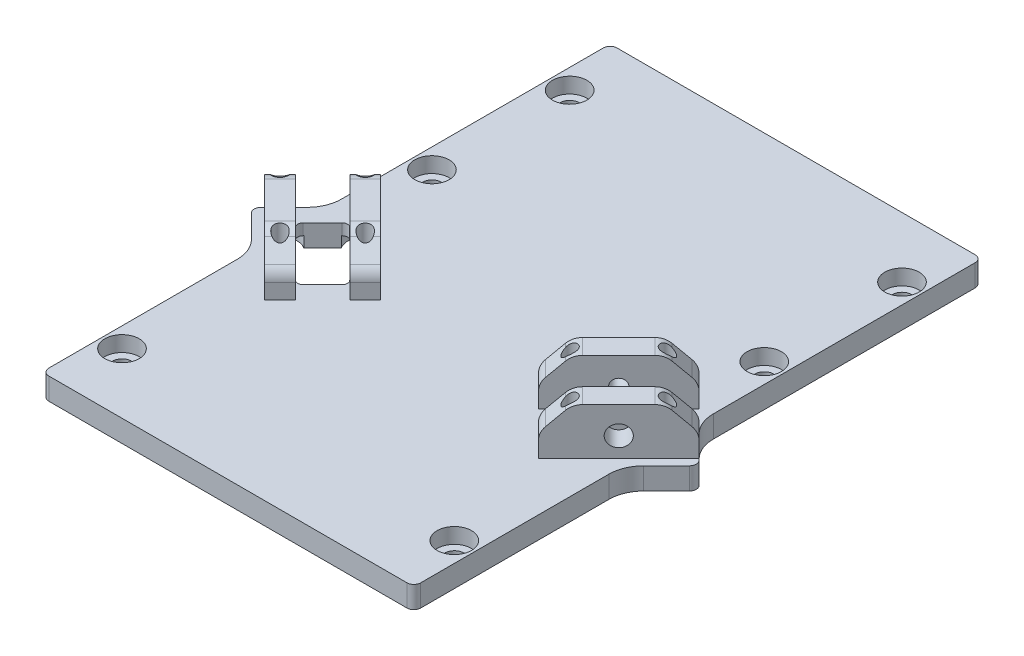
from build123d import *

# Parameters (mm, degrees)
SKETCH1_W                           = 130
SKETCH1_H                           = 55
BOSS_EXTRUDE1_DEPTH                 = 6.35
BOSS_EXTRUDE2_DEPTH                 = 13.5
BOSS_EXTRUDE2_2_DEPTH               = 13.5
SKETCH4_W                           = 2.1
SKETCH4_H                           = 107.03086207
CHAMFER1_SIZE                       = 7
FILLET1_R                           = 5
CHAMFER2_SIZE                       = 7
FILLET2_R                           = 5
CUT_EXTRUDE1_DEPTH                  = 72.857497869
SKETCH10_W                          = 3
SKETCH10_H                          = 107.03086207
SKETCH12_W                          = 1.9
SKETCH12_H                          = 19.85
F_3_8_3_8_DIAMETER_HOLE1_AT_2_COUNT = 2
F_3_8_3_8_DIAMETER_HOLE1_AT_2_PITCH = 20
F_3_8_3_8_DIAMETER_HOLE1_AT_3_COUNT = 2
F_3_8_3_8_DIAMETER_HOLE1_AT_3_PITCH = 26.575364532
F_3_8_3_8_DIAMETER_HOLE1_AT_4_COUNT = 2
F_3_8_3_8_DIAMETER_HOLE1_AT_4_PITCH = 17.5
F_3_8_3_8_DIAMETER_HOLE1_AT_5_COUNT = 2
F_3_8_3_8_DIAMETER_HOLE1_AT_5_PITCH = 87.767766953
F_3_8_3_8_DIAMETER_HOLE1_AT_6_COUNT = 2
F_3_8_3_8_DIAMETER_HOLE1_AT_6_PITCH = 100.903777567
F_3_8_3_8_DIAMETER_HOLE1_AT_7_COUNT = 2
F_3_8_3_8_DIAMETER_HOLE1_AT_7_PITCH = 89.995138758
F_3_8_3_8_DIAMETER_HOLE1_AT_8_COUNT = 2
F_3_8_3_8_DIAMETER_HOLE1_AT_8_PITCH = 74.971551862
CBORE_FOR_M5_SHCS2_AT_2_COUNT       = 2
CBORE_FOR_M5_SHCS2_AT_2_PITCH       = 20
CBORE_FOR_M5_SHCS2_AT_3_COUNT       = 2
CBORE_FOR_M5_SHCS2_AT_3_PITCH       = 17.5
CBORE_FOR_M5_SHCS2_AT_4_COUNT       = 2
CBORE_FOR_M5_SHCS2_AT_4_PITCH       = 26.575364532
CBORE_FOR_M5_SHCS2_AT_5_COUNT       = 2
CBORE_FOR_M5_SHCS2_AT_5_PITCH       = 86.018166686
CBORE_FOR_M5_SHCS2_AT_6_COUNT       = 2
CBORE_FOR_M5_SHCS2_AT_6_PITCH       = 72.915551652
CBORE_FOR_M5_SHCS2_AT_7_COUNT       = 2
CBORE_FOR_M5_SHCS2_AT_7_PITCH       = 74.971551862
CBORE_FOR_M5_SHCS2_AT_8_COUNT       = 2
CBORE_FOR_M5_SHCS2_AT_8_PITCH       = 59.483495706
SKETCH7_W                           = 108
SKETCH7_H                           = 68
SKETCH7_H_2                         = 42
BOSS_EXTRUDE3_DEPTH                 = 6.35
CUT_EXTRUDE2_DEPTH                  = 12.7
CBORE_FOR_M5_SHCS1_AT_2_COUNT       = 2
CBORE_FOR_M5_SHCS1_AT_2_PITCH       = 40
CBORE_FOR_M5_SHCS1_AT_3_COUNT       = 2
CBORE_FOR_M5_SHCS1_AT_3_PITCH       = 104.461715475
CBORE_FOR_M5_SHCS1_AT_4_COUNT       = 2
CBORE_FOR_M5_SHCS1_AT_4_PITCH       = 96.5
CBORE_FOR_M5_SHCS1_AT_5_COUNT       = 2
CBORE_FOR_M5_SHCS1_AT_5_PITCH       = 130
CBORE_FOR_M5_SHCS1_AT_6_COUNT       = 2
CBORE_FOR_M5_SHCS1_AT_6_PITCH       = 161.901976517
FILLET3_R                           = 10
FILLET4_R                           = 2


with BuildPart() as part:
    # Sketch1 → Boss-Extrude1 (new body)
    with BuildSketch(Plane(origin=(0, 0, 0), x_dir=(1, 0, 0), z_dir=(0, 1, 0))):
        Rectangle(SKETCH1_W, SKETCH1_H)
    extrude(amount=BOSS_EXTRUDE1_DEPTH)

    # Sketch6 → Cut-Extrude1 (cut, through all)
    with BuildSketch(Plane(origin=(0, 6.35, 0), x_dir=(1, 0, 0), z_dir=(0, 1, 0))):
        with BuildLine():
            Line((-53.597762883, 3.713522273), (-40.286477727, -9.597762883))
            ThreePointArc((-40.286477727, -9.597762883), (-39.163945712, -10.062730868), (-38.041413697, -9.597762883))
            Line((-38.041413697, -9.597762883), (-32.402237117, -3.958586303))
            ThreePointArc((-32.402237117, -3.958586303), (-31.937269132, -2.836054288), (-32.402237117, -1.713522273))
            Line((-32.402237117, -1.713522273), (-45.713522273, 11.597762883))
            ThreePointArc((-45.713522273, 11.597762883), (-46.836054288, 12.062730868), (-47.958586303, 11.597762883))
            Line((-47.958586303, 11.597762883), (-53.597762883, 5.958586303))
            ThreePointArc((-53.597762883, 5.958586303), (-54.062730868, 4.836054288), (-53.597762883, 3.713522273))
        make_face()
        with BuildLine():
            Line((47.958586303, 11.597762883), (53.597762883, 5.958586303))
            ThreePointArc((53.597762883, 5.958586303), (54.062730868, 4.836054288), (53.597762883, 3.713522273))
            Line((53.597762883, 3.713522273), (40.286477727, -9.597762883))
            ThreePointArc((40.286477727, -9.597762883), (39.163945712, -10.062730868), (38.041413697, -9.597762883))
            Line((38.041413697, -9.597762883), (32.402237117, -3.958586303))
            ThreePointArc((32.402237117, -3.958586303), (31.937269132, -2.836054288), (32.402237117, -1.713522273))
            Line((32.402237117, -1.713522273), (45.713522273, 11.597762883))
            ThreePointArc((45.713522273, 11.597762883), (46.836054288, 12.062730868), (47.958586303, 11.597762883))
        make_face()
    extrude(amount=-CUT_EXTRUDE1_DEPTH, mode=Mode.SUBTRACT)


with BuildPart() as body_2:
    # Sketch2 → Boss-Extrude2 (new body)
    with BuildSketch(Plane(origin=(0, 6.35, 0), x_dir=(1, 0, 0), z_dir=(0, 1, 0))):
        Polygon((-63.099510255, 4.235013524), (-39.764986476, -19.099510255), (-35.274858416, -14.609382195), (-58.609382195, 8.725141584), align=None)
    extrude(amount=BOSS_EXTRUDE2_DEPTH)


with BuildPart() as body_3:
    # Sketch2 → Boss-Extrude2 2 (new body)
    with BuildSketch(Plane(origin=(0, 6.35, 0), x_dir=(1, 0, 0), z_dir=(0, 1, 0))):
        Polygon((-22.900489745, -2.235013524), (-27.390617805, -6.725141584), (-50.725141584, 16.609382195), (-46.235013524, 21.099510255), align=None)
    extrude(amount=BOSS_EXTRUDE2_2_DEPTH)


with BuildPart() as tap_drill_for_m5x0_8_tap1_tool:
    # Sketch4 → Tap Drill for M5x0.8 Tap1 (revolve)
    with BuildSketch(Plane(origin=(-51.432248366, 12, 7.432248366), x_dir=(0.7071067811865477, 0, 0.7071067811865475), z_dir=(0, 1, 0))):
        with Locations((1.05, 53.515431035)):
            Rectangle(SKETCH4_W, SKETCH4_H)
    revolve(axis=Axis((-55.922376426, 12, 11.922376426), (0.7071067811865475, 0, -0.7071067811865477)))


with BuildPart() as body_2_1:
    add(body_2.part)

    # Tap Drill for M5x0.8 Tap1: cut by tap_drill_for_m5x0_8_tap1_tool
    add(tap_drill_for_m5x0_8_tap1_tool.part, mode=Mode.SUBTRACT)

    # Chamfer1
    chamfer1_edges = [body_2_1.edges().sort_by_distance(p)[0] for p in [
        (-37.519922446, 19.85, 16.854446225),
        (-60.854446225, 19.85, -6.480077554),
    ]]
    chamfer(chamfer1_edges, length=CHAMFER1_SIZE)

    # Fillet1
    fillet1_edges = [body_2_1.edges().sort_by_distance(p)[0] for p in [
        (-55.904698757, 19.85, -1.530330086),
        (-42.469669914, 19.85, 11.904698757),
        (-37.519922446, 12.85, 16.854446225),
        (-60.854446225, 12.85, -6.480077554),
    ]]
    fillet(fillet1_edges, radius=FILLET1_R)

    # Sketch10 → Ø6.0 (6) Diameter Hole1 (revolve, cut)
    with BuildSketch(Plane(origin=(-51.432248366, 12, 7.432248366), x_dir=(0.7071067811865479, 0, 0.7071067811865472), z_dir=(0, 1, 0))):
        with Locations((1.5, 53.515431035)):
            Rectangle(SKETCH10_W, SKETCH10_H)
    revolve(axis=Axis((-55.922376426, 12, 11.922376426), (0.7071067811865474, 0, -0.7071067811865478)), mode=Mode.SUBTRACT)


with BuildPart() as body_3_1:
    add(body_3.part)

    # Tap Drill for M5x0.8 Tap1: cut by tap_drill_for_m5x0_8_tap1_tool
    add(tap_drill_for_m5x0_8_tap1_tool.part, mode=Mode.SUBTRACT)

    # Chamfer2
    chamfer2_edges = [body_3_1.edges().sort_by_distance(p)[0] for p in [
        (-25.145553775, 19.85, 4.480077554),
        (-48.480077554, 19.85, -18.854446225),
    ]]
    chamfer(chamfer2_edges, length=CHAMFER2_SIZE)

    # Fillet2
    fillet2_edges = [body_3_1.edges().sort_by_distance(p)[0] for p in [
        (-43.530330086, 19.85, -13.904698757),
        (-30.095301243, 19.85, -0.469669914),
        (-25.145553775, 12.85, 4.480077554),
        (-48.480077554, 12.85, -18.854446225),
    ]]
    fillet(fillet2_edges, radius=FILLET2_R)


with BuildPart() as f_3_8_3_8_diameter_hole1_tool:
    # Sketch12 → Ø3.8 (3.8) Diameter Hole1 (revolve)
    with BuildSketch(Plane(origin=(-43.883883476, 0, -14.258252147), x_dir=(0, 0, -1), z_dir=(1, 0, 0))):
        with Locations((0.95, 9.925)):
            Rectangle(SKETCH12_W, SKETCH12_H)
    f_3_8_3_8_diameter_hole1 = revolve(axis=Axis((-43.883883476, -6.35, -14.258252147), (0, 1, 0)))


with BuildPart() as part_1:
    add(part.part)

    # Ø3.8 (3.8) Diameter Hole1: cut by f_3_8_3_8_diameter_hole1_tool
    add(f_3_8_3_8_diameter_hole1_tool.part, mode=Mode.SUBTRACT)


with BuildPart() as body_3_2:
    add(body_3_1.part)

    # Ø3.8 (3.8) Diameter Hole1: cut by f_3_8_3_8_diameter_hole1_tool
    add(f_3_8_3_8_diameter_hole1_tool.part, mode=Mode.SUBTRACT)


with BuildPart() as f_3_8_3_8_diameter_hole1_at_2_tool:
    # Ø3.8 (3.8) Diameter Hole1 at 2: Ø3.8 (3.8) Diameter Hole1 ×2
    with Locations(*[Vector(0.7071067811865479, 0, 0.7071067811865471) * (i * F_3_8_3_8_DIAMETER_HOLE1_AT_2_PITCH) for i in range(1, F_3_8_3_8_DIAMETER_HOLE1_AT_2_COUNT)]):
        add(f_3_8_3_8_diameter_hole1)


with BuildPart() as part_2:
    add(part_1.part)

    # Ø3.8 (3.8) Diameter Hole1 at 2: cut by f_3_8_3_8_diameter_hole1_at_2_tool
    add(f_3_8_3_8_diameter_hole1_at_2_tool.part, mode=Mode.SUBTRACT)


with BuildPart() as body_3_3:
    add(body_3_2.part)

    # Ø3.8 (3.8) Diameter Hole1 at 2: cut by f_3_8_3_8_diameter_hole1_at_2_tool
    add(f_3_8_3_8_diameter_hole1_at_2_tool.part, mode=Mode.SUBTRACT)


with BuildPart() as f_3_8_3_8_diameter_hole1_at_3_tool:
    # Ø3.8 (3.8) Diameter Hole1 at 3: Ø3.8 (3.8) Diameter Hole1 ×2
    with Locations(*[Vector(0.06651901052377422, 0, 0.997785157856609) * (i * F_3_8_3_8_DIAMETER_HOLE1_AT_3_PITCH) for i in range(1, F_3_8_3_8_DIAMETER_HOLE1_AT_3_COUNT)]):
        add(f_3_8_3_8_diameter_hole1)


with BuildPart() as part_3:
    add(part_2.part)

    # Ø3.8 (3.8) Diameter Hole1 at 3: cut by f_3_8_3_8_diameter_hole1_at_3_tool
    add(f_3_8_3_8_diameter_hole1_at_3_tool.part, mode=Mode.SUBTRACT)


with BuildPart() as body_2_2:
    add(body_2_1.part)

    # Ø3.8 (3.8) Diameter Hole1 at 3: cut by f_3_8_3_8_diameter_hole1_at_3_tool
    add(f_3_8_3_8_diameter_hole1_at_3_tool.part, mode=Mode.SUBTRACT)


with BuildPart() as f_3_8_3_8_diameter_hole1_at_4_tool:
    # Ø3.8 (3.8) Diameter Hole1 at 4: Ø3.8 (3.8) Diameter Hole1 ×2
    with Locations(*[Vector(-0.7071067811865472, 0, 0.7071067811865478) * (i * F_3_8_3_8_DIAMETER_HOLE1_AT_4_PITCH) for i in range(1, F_3_8_3_8_DIAMETER_HOLE1_AT_4_COUNT)]):
        add(f_3_8_3_8_diameter_hole1)


with BuildPart() as part_4:
    add(part_3.part)

    # Ø3.8 (3.8) Diameter Hole1 at 4: cut by f_3_8_3_8_diameter_hole1_at_4_tool
    add(f_3_8_3_8_diameter_hole1_at_4_tool.part, mode=Mode.SUBTRACT)

    # Ø3.8 (3.8) Diameter Hole1 at 5: Ø3.8 (3.8) Diameter Hole1 ×2
    with Locations(*[(i * F_3_8_3_8_DIAMETER_HOLE1_AT_5_PITCH, 0, 0) for i in range(1, F_3_8_3_8_DIAMETER_HOLE1_AT_5_COUNT)]):
        add(f_3_8_3_8_diameter_hole1, mode=Mode.SUBTRACT)

    # Ø3.8 (3.8) Diameter Hole1 at 6: Ø3.8 (3.8) Diameter Hole1 ×2
    with Locations(*[Vector(0.992451799510483, 0, 0.12263533605125418) * (i * F_3_8_3_8_DIAMETER_HOLE1_AT_6_PITCH) for i in range(1, F_3_8_3_8_DIAMETER_HOLE1_AT_6_COUNT)]):
        add(f_3_8_3_8_diameter_hole1, mode=Mode.SUBTRACT)

    # Ø3.8 (3.8) Diameter Hole1 at 7: Ø3.8 (3.8) Diameter Hole1 ×2
    with Locations(*[Vector(0.9556071715344254, 0, 0.29464374032376006) * (i * F_3_8_3_8_DIAMETER_HOLE1_AT_7_PITCH) for i in range(1, F_3_8_3_8_DIAMETER_HOLE1_AT_7_COUNT)]):
        add(f_3_8_3_8_diameter_hole1, mode=Mode.SUBTRACT)

    # Ø3.8 (3.8) Diameter Hole1 at 8: Ø3.8 (3.8) Diameter Hole1 ×2
    with Locations(*[Vector(0.9820475833893477, 0, 0.18863335855341756) * (i * F_3_8_3_8_DIAMETER_HOLE1_AT_8_PITCH) for i in range(1, F_3_8_3_8_DIAMETER_HOLE1_AT_8_COUNT)]):
        add(f_3_8_3_8_diameter_hole1, mode=Mode.SUBTRACT)

    # Sketch14 → CBORE for M5 SHCS2 (revolve, cut)
    with BuildSketch(Plane(origin=(-29.741747853, 0, -0.116116524), x_dir=(0, 0, -1), z_dir=(1, 0, 0))):
        Polygon((0, 0), (0, 19.85), (2.375, 19.85), (2.375, 3.1), (5, 3.1), (5, 0), align=None)
    cbore_for_m5_shcs2 = revolve(axis=Axis((-29.741747853, -6.35, -0.116116524), (0, 1, 0)), mode=Mode.SUBTRACT)

    # CBORE for M5 SHCS2 at 2: CBORE for M5 SHCS2 ×2
    with Locations(*[Vector(-0.7071067811865479, 0, -0.7071067811865471) * (i * CBORE_FOR_M5_SHCS2_AT_2_PITCH) for i in range(1, CBORE_FOR_M5_SHCS2_AT_2_COUNT)]):
        add(cbore_for_m5_shcs2, mode=Mode.SUBTRACT)

    # CBORE for M5 SHCS2 at 3: CBORE for M5 SHCS2 ×2
    with Locations(*[Vector(-0.707106781186547, 0, 0.7071067811865481) * (i * CBORE_FOR_M5_SHCS2_AT_3_PITCH) for i in range(1, CBORE_FOR_M5_SHCS2_AT_3_COUNT)]):
        add(cbore_for_m5_shcs2, mode=Mode.SUBTRACT)

    # CBORE for M5 SHCS2 at 4: CBORE for M5 SHCS2 ×2
    with Locations(*[Vector(-0.997785157856609, 0, -0.06651901052377292) * (i * CBORE_FOR_M5_SHCS2_AT_4_PITCH) for i in range(1, CBORE_FOR_M5_SHCS2_AT_4_COUNT)]):
        add(cbore_for_m5_shcs2, mode=Mode.SUBTRACT)

    # CBORE for M5 SHCS2 at 5: CBORE for M5 SHCS2 ×2
    with Locations(*[Vector(0.9997888040796394, 0, -0.020551088462764266) * (i * CBORE_FOR_M5_SHCS2_AT_5_PITCH) for i in range(1, CBORE_FOR_M5_SHCS2_AT_5_COUNT)]):
        add(cbore_for_m5_shcs2, mode=Mode.SUBTRACT)

    # CBORE for M5 SHCS2 at 6: CBORE for M5 SHCS2 ×2
    with Locations(*[Vector(0.9854943526890146, 0, 0.16970822260002638) * (i * CBORE_FOR_M5_SHCS2_AT_6_PITCH) for i in range(1, CBORE_FOR_M5_SHCS2_AT_6_COUNT)]):
        add(cbore_for_m5_shcs2, mode=Mode.SUBTRACT)

    # CBORE for M5 SHCS2 at 7: CBORE for M5 SHCS2 ×2
    with Locations(*[Vector(0.9820475833893478, 0, -0.1886333585534172) * (i * CBORE_FOR_M5_SHCS2_AT_7_PITCH) for i in range(1, CBORE_FOR_M5_SHCS2_AT_7_COUNT)]):
        add(cbore_for_m5_shcs2, mode=Mode.SUBTRACT)

    # CBORE for M5 SHCS2 at 8: CBORE for M5 SHCS2 ×2
    with Locations(*[(i * CBORE_FOR_M5_SHCS2_AT_8_PITCH, 0, 0) for i in range(1, CBORE_FOR_M5_SHCS2_AT_8_COUNT)]):
        add(cbore_for_m5_shcs2, mode=Mode.SUBTRACT)

    # Sketch7 → Boss-Extrude3 (add)
    with BuildSketch(Plane(origin=(0, 6.35, 0), x_dir=(1, 0, 0), z_dir=(0, 1, 0))):
        with Locations((0, 61.5)):
            Rectangle(SKETCH7_W, SKETCH7_H)
        with Locations((0, -48.5)):
            Rectangle(SKETCH7_W, SKETCH7_H_2)
    extrude(amount=-BOSS_EXTRUDE3_DEPTH)

    # Sketch7<3> → Cut-Extrude2 (cut)
    with BuildSketch(Plane(origin=(0, 6.35, 0), x_dir=(1, 0, 0), z_dir=(0, 1, 0))):
        Polygon((65, -27.5), (65, 2.334523779), (54, -8.665476221), (54, -27.5), align=None)
        Polygon((54, 13.334523779), (65, 2.334523779), (65, 27.5), (54, 27.5), align=None)
        Polygon((-65, -27.5), (-54, -27.5), (-54, -8.665476221), (-65, 2.334523779), align=None)
        Polygon((-65, 2.334523779), (-54, 13.334523779), (-54, 27.5), (-65, 27.5), align=None)
    extrude(amount=-CUT_EXTRUDE2_DEPTH, mode=Mode.SUBTRACT)

    # Sketch8 → CBORE for M5 SHCS1 (revolve, cut)
    with BuildSketch(Plane(origin=(48.25, 6.35, -78), x_dir=(0, 0, 1), z_dir=(1, 0, 0))):
        Polygon((0, 0), (0, 6.35), (2.75, 6.35), (2.75, 4.5), (5, 4.5), (5, 0), align=None)
    cbore_for_m5_shcs1 = revolve(axis=Axis((48.25, 12.7, -78), (0, -1, 0)), mode=Mode.SUBTRACT)

    # CBORE for M5 SHCS1 at 2: CBORE for M5 SHCS1 ×2
    with Locations(*[(0, 0, i * CBORE_FOR_M5_SHCS1_AT_2_PITCH) for i in range(1, CBORE_FOR_M5_SHCS1_AT_2_COUNT)]):
        add(cbore_for_m5_shcs1, mode=Mode.SUBTRACT)

    # CBORE for M5 SHCS1 at 3: CBORE for M5 SHCS1 ×2
    with Locations(*[Vector(-0.9237834125269129, 0, 0.38291540415623343) * (i * CBORE_FOR_M5_SHCS1_AT_3_PITCH) for i in range(1, CBORE_FOR_M5_SHCS1_AT_3_COUNT)]):
        add(cbore_for_m5_shcs1, mode=Mode.SUBTRACT)

    # CBORE for M5 SHCS1 at 4: CBORE for M5 SHCS1 ×2
    with Locations(*[(-i * CBORE_FOR_M5_SHCS1_AT_4_PITCH, 0, 0) for i in range(1, CBORE_FOR_M5_SHCS1_AT_4_COUNT)]):
        add(cbore_for_m5_shcs1, mode=Mode.SUBTRACT)

    # CBORE for M5 SHCS1 at 5: CBORE for M5 SHCS1 ×2
    with Locations(*[(0, 0, i * CBORE_FOR_M5_SHCS1_AT_5_PITCH) for i in range(1, CBORE_FOR_M5_SHCS1_AT_5_COUNT)]):
        add(cbore_for_m5_shcs1, mode=Mode.SUBTRACT)

    # CBORE for M5 SHCS1 at 6: CBORE for M5 SHCS1 ×2
    with Locations(*[Vector(-0.5960396659522684, 0, 0.8029549904020201) * (i * CBORE_FOR_M5_SHCS1_AT_6_PITCH) for i in range(1, CBORE_FOR_M5_SHCS1_AT_6_COUNT)]):
        add(cbore_for_m5_shcs1, mode=Mode.SUBTRACT)

    # Fillet3
    fillet3_edges = [part_4.edges().sort_by_distance(p)[0] for p in [
        (-54, 3.175, -13.334523779),
        (-54, 3.175, 8.665476221),
        (54, 3.175, 8.665476221),
        (54, 3.175, -13.334523779),
    ]]
    fillet(fillet3_edges, radius=FILLET3_R)

    # Fillet4
    fillet4_edges = [part_4.edges().sort_by_distance(p)[0] for p in [
        (54, 3.175, -95.5),
        (-54, 3.175, 69.5),
        (54, 3.175, 69.5),
        (65, 3.175, -2.334523779),
        (-54, 3.175, -95.5),
        (-65, 3.175, -2.334523779),
    ]]
    fillet(fillet4_edges, radius=FILLET4_R)


with BuildPart() as body_2_3:
    add(body_2_2.part)

    # Ø3.8 (3.8) Diameter Hole1 at 4: cut by f_3_8_3_8_diameter_hole1_at_4_tool
    add(f_3_8_3_8_diameter_hole1_at_4_tool.part, mode=Mode.SUBTRACT)


with BuildPart() as body_4:
    # Mirror1: mirrored copy
    add(body_2_3.part.mirror(Plane(origin=(0, 0, 0), x_dir=(0, 0, 1), z_dir=(1, 0, 0))))


with BuildPart() as body_5:
    # Mirror1 2: mirrored copy
    add(body_3_3.part.mirror(Plane(origin=(0, 0, 0), x_dir=(0, 0, 1), z_dir=(1, 0, 0))))


solid = Compound([body_3_3.part, part_4.part, body_2_3.part, body_4.part, body_5.part])
